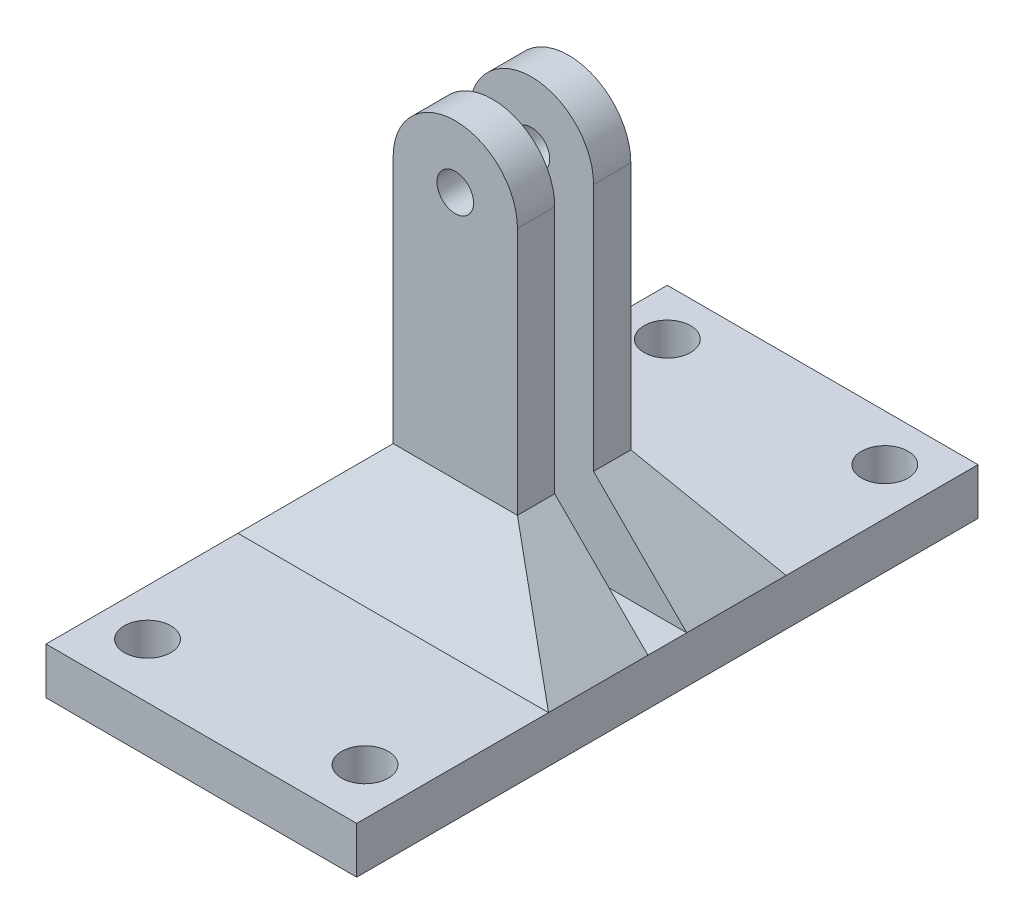
from build123d import *

# Parameters (mm, degrees)
SKETCH1_W           = 20
SKETCH1_H           = 40
BOSS_EXTRUDE1_DEPTH = 3
SKETCH4_W           = 8
SKETCH4_H           = 2.4
BOSS_EXTRUDE2_DEPTH = 20
CUT_EXTRUDE1_REACH  = 40.734
SKETCH5_R           = 1.178679728
SKETCH6_R           = 1.5
CUT_EXTRUDE2_DEPTH  = 3


with BuildPart() as part:
    # Sketch1 → Boss-Extrude1 (new body)
    with BuildSketch(Plane(origin=(0, 0, 0), x_dir=(1, 0, 0), z_dir=(0, 1, 0))):
        Rectangle(SKETCH1_W, SKETCH1_H)
    extrude(amount=BOSS_EXTRUDE1_DEPTH)

    # Sketch2 → Loft3 section 0
    with BuildSketch(Plane(origin=(0, 3, 0), x_dir=(1, 0, 0), z_dir=(0, 1, 0))):
        with BuildLine():
            Line((-10, 7.65), (10, 7.65))
            Line((10, 7.65), (10, 1.25))
            Line((10, 1.25), (-10, 1.25))
            Line((-10, 1.25), (-10, 7.65))
        make_face()
    # Sketch3 → Loft3 section 1
    with BuildSketch(Plane(origin=(0, 9, 0), x_dir=(1, 0, 0), z_dir=(0, 1, 0))):
        with BuildLine():
            Line((-4, 3.65), (4, 3.65))
            Line((4, 3.65), (4, 1.25))
            Line((4, 1.25), (-4, 1.25))
            Line((-4, 1.25), (-4, 3.65))
        make_face()
    loft3 = loft()

    # Mirror1: Loft3 across plane
    add(loft3.mirror(Plane(origin=(0, 0, 0), x_dir=(1, 0, 0), z_dir=(0, 0, -1))))

    # Sketch4 → Boss-Extrude2 (add)
    with BuildSketch(Plane(origin=(0, 9, 0), x_dir=(1, 0, 0), z_dir=(0, 1, 0))):
        with Locations((0, 2.45)):
            Rectangle(SKETCH4_W, SKETCH4_H)
        with Locations((0, -2.45)):
            Rectangle(SKETCH4_W, SKETCH4_H)
    extrude(amount=BOSS_EXTRUDE2_DEPTH)

    # Cut-Extrude1: up to this face of the body (flat: up to its plane)
    cut_extrude1_end = Plane(part.part.faces().sort_by_distance((0, 19, -3.65))[0])
    # Sketch5 → Cut-Extrude1 (cut, up to the picked face)
    with BuildSketch(Plane.XY.offset(3.65), mode=Mode.PRIVATE) as cut_extrude1_sk1:
        with BuildLine():
            Line((-4, 29), (-4, 25))
            ThreePointArc((-4, 25), (-2.828427125, 27.828427125), (0, 29))
            Line((0, 29), (-4, 29))
        make_face()
    cut_extrude1_tool1 = split(extrude(cut_extrude1_sk1.sketch, amount=-CUT_EXTRUDE1_REACH, mode=Mode.PRIVATE), bisect_by=cut_extrude1_end, keep=Keep.BOTH, mode=Mode.PRIVATE)
    # Sketch5 → Cut-Extrude1 (cut, up to the picked face)
    with BuildSketch(Plane.XY.offset(3.65), mode=Mode.PRIVATE) as cut_extrude1_sk2:
        with BuildLine():
            Line((4, 29), (0, 29))
            ThreePointArc((0, 29), (2.828427125, 27.828427125), (4, 25))
            Line((4, 25), (4, 29))
        make_face()
    cut_extrude1_tool2 = split(extrude(cut_extrude1_sk2.sketch, amount=-CUT_EXTRUDE1_REACH, mode=Mode.PRIVATE), bisect_by=cut_extrude1_end, keep=Keep.BOTH, mode=Mode.PRIVATE)
    # Sketch5 → Cut-Extrude1 (cut, up to the picked face)
    with BuildSketch(Plane.XY.offset(3.65), mode=Mode.PRIVATE) as cut_extrude1_sk3:
        with Locations((0, 25)):
            Circle(SKETCH5_R)
    cut_extrude1_tool3 = split(extrude(cut_extrude1_sk3.sketch, amount=-CUT_EXTRUDE1_REACH, mode=Mode.PRIVATE), bisect_by=cut_extrude1_end, keep=Keep.BOTH, mode=Mode.PRIVATE)
    add(cut_extrude1_tool1.solids().sort_by(Axis((-3.106528, 28.106528, 3.65), (0, 0, -1)))[0], mode=Mode.SUBTRACT)
    add(cut_extrude1_tool2.solids().sort_by(Axis((3.106528, 28.106528, 3.65), (0, 0, -1)))[0], mode=Mode.SUBTRACT)
    add(cut_extrude1_tool3.solids().sort_by(Axis((0, 25, 3.65), (0, 0, -1)))[0], mode=Mode.SUBTRACT)

    # Sketch6 → Cut-Extrude2 (cut)
    with BuildSketch(Plane(origin=(0, 3, 0), x_dir=(1, 0, 0), z_dir=(0, 1, 0))):
        with Locations(Location((7, 17, 0), (0, 0, 270))):
            Circle(SKETCH6_R)
        with Locations(Location((-7, 17, 0), (0, 0, 270))):
            Circle(SKETCH6_R)
        with Locations(Location((7, -16.463590195, 0), (0, 0, 270))):
            Circle(SKETCH6_R)
        with Locations(Location((-7, -16.463590195, 0), (0, 0, 270))):
            Circle(SKETCH6_R)
    extrude(amount=-CUT_EXTRUDE2_DEPTH, mode=Mode.SUBTRACT)


solid = part.part
